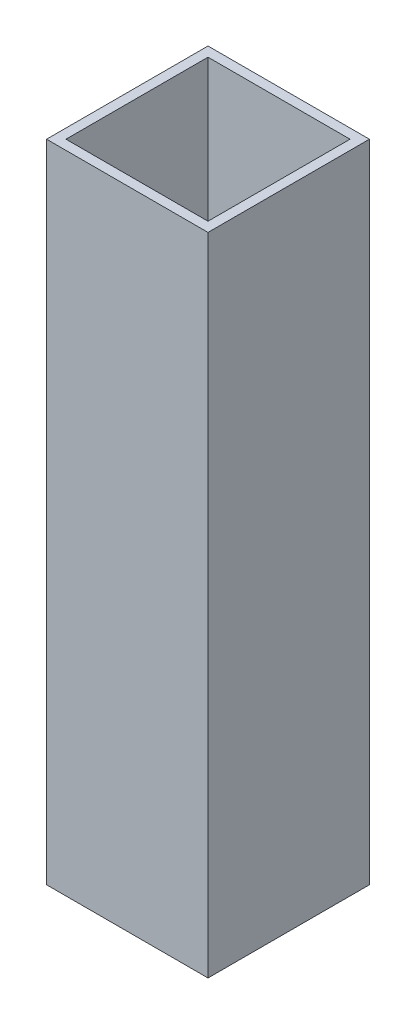
from build123d import *

# Parameters (mm, degrees)
BOSS_EXTRUDE1_DEPTH      = 50
BOSS_EXTRUDE1_DEPTH_BACK = 50
SKETCH3_W                = 25
SKETCH3_H                = 25
SKETCH3_W_2              = 22
SKETCH3_H_2              = 22


with BuildPart() as part:
    # Sketch3 → Boss-Extrude1 (new, two sides: drawn at the far end of the back side and taken through both)
    with BuildSketch(Plane(origin=(0, 0, 0), x_dir=(1, 0, 0), z_dir=(0, 1, 0)).offset(-BOSS_EXTRUDE1_DEPTH_BACK)):
        Rectangle(SKETCH3_W, SKETCH3_H)
        Rectangle(SKETCH3_W_2, SKETCH3_H_2, mode=Mode.SUBTRACT)
    extrude(amount=BOSS_EXTRUDE1_DEPTH + BOSS_EXTRUDE1_DEPTH_BACK)


solid = part.part
